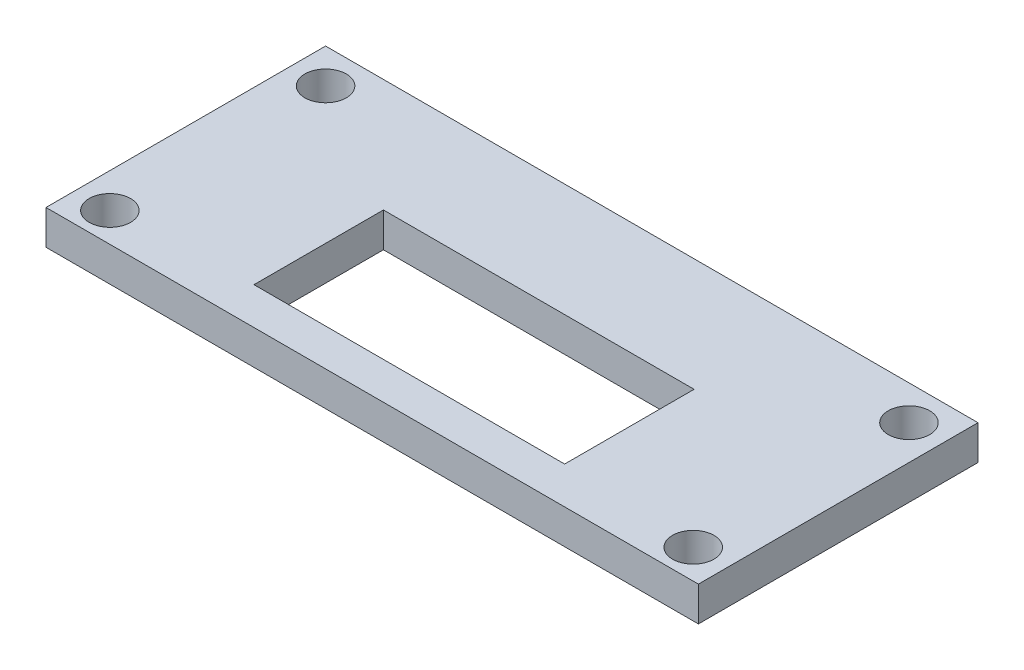
from build123d import *

# Parameters (mm, degrees)
SKETCH1_W                = 37.8
SKETCH1_H                = 16.2
RETAINER_PLATE_DEPTH     = 2
SKETCH2_W                = 18
SKETCH2_H                = 7.5
RIBBON_SLOT_DEPTH        = 4
SKETCH3_R                = 1.2
M2_CLEARANCE_HOLES_DEPTH = 4


with BuildPart() as part:
    # Sketch1 → Retainer Plate (new body)
    with BuildSketch(Plane(origin=(0, 15, 0), x_dir=(1, 0, 0), z_dir=(0, 1, 0))):
        with Locations((0, 37.4)):
            Rectangle(SKETCH1_W, SKETCH1_H)
    extrude(amount=RETAINER_PLATE_DEPTH)

    # Sketch2 → Ribbon Slot (cut)
    with BuildSketch(Plane(origin=(0, 14, 0), x_dir=(1, 0, 0), z_dir=(0, 1, 0))):
        with Locations((0, 35.2)):
            Rectangle(SKETCH2_W, SKETCH2_H)
    extrude(amount=RIBBON_SLOT_DEPTH, mode=Mode.SUBTRACT)

    # Sketch3 → M2 Clearance Holes (cut)
    with BuildSketch(Plane(origin=(0, 14, 0), x_dir=(1, 0, 0), z_dir=(0, 1, 0))):
        with Locations(Location((-16.9, 31, 0), (0, 0, 270))):
            Circle(SKETCH3_R)
        with Locations(Location((-16.9, 43.5, 0), (0, 0, 270))):
            Circle(SKETCH3_R)
        with Locations(Location((16.9, 31, 0), (0, 0, 270))):
            Circle(SKETCH3_R)
        with Locations(Location((16.9, 43.5, 0), (0, 0, 270))):
            Circle(SKETCH3_R)
    extrude(amount=M2_CLEARANCE_HOLES_DEPTH, mode=Mode.SUBTRACT)


solid = part.part
